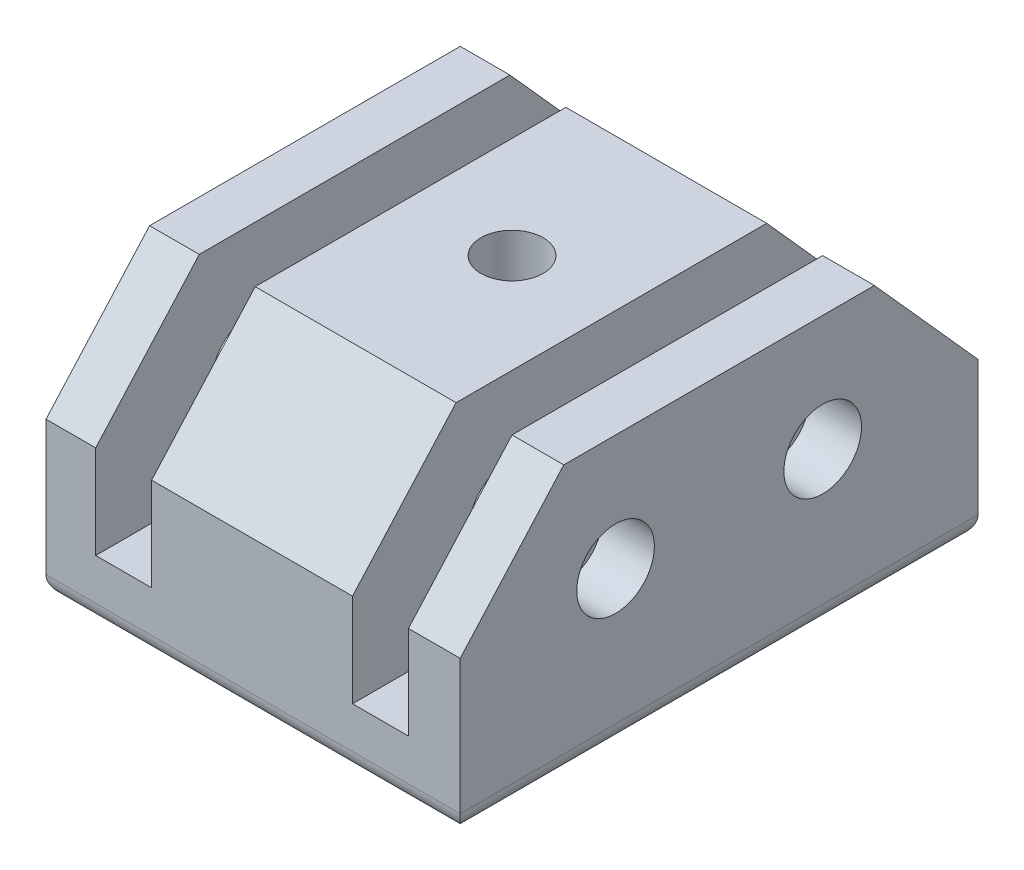
from build123d import *

# Parameters (mm, degrees)
SKETCH1_W           = 63.5
SKETCH1_H           = 6.35
BOSS_EXTRUDE1_DEPTH = 50.8
BOSS_EXTRUDE2_DEPTH = 50.8
SKETCH10_W          = 6.858
SKETCH10_H          = 25.629031657
CUT_EXTRUDE1_DEPTH  = 88.854357354
LPATTERN3_COUNT     = 2
LPATTERN3_PITCH     = 31.496
SKETCH11_R          = 4.7625
CUT_EXTRUDE2_DEPTH  = 88.854357354
FILLET1_R           = 2.54
SKETCH24_R          = 3.81
CUT_EXTRUDE10_DEPTH = 88.854357354
CUT_EXTRUDE11_DEPTH = 6.35


with BuildPart() as part:
    # Sketch1 → Boss-Extrude1 (new body)
    with BuildSketch(Plane(origin=(0, 0, 0), x_dir=(0, 0, -1), z_dir=(1, 0, 0))):
        with Locations((31.75, 3.175)):
            Rectangle(SKETCH1_W, SKETCH1_H)
    extrude(amount=-BOSS_EXTRUDE1_DEPTH)

    # Sketch2 → Boss-Extrude2 (add)
    with BuildSketch(Plane(origin=(0, 0, 0), x_dir=(0, 0, -1), z_dir=(1, 0, 0))):
        Polygon((0, 6.35), (0, 19.05), (12.7, 33.249031657), (50.8, 33.249031657), (63.5, 19.05), (63.5, 6.35), align=None)
    extrude(amount=-BOSS_EXTRUDE2_DEPTH)

    # Sketch10 → Cut-Extrude1 (cut, through all)
    with BuildSketch(Plane(origin=(0, 0, -63.5), x_dir=(-1, 0, 0), z_dir=(0, 0, -1))):
        with Locations((9.779, 20.434515829)):
            Rectangle(SKETCH10_W, SKETCH10_H)
    cut_extrude1 = extrude(amount=-CUT_EXTRUDE1_DEPTH, mode=Mode.SUBTRACT)

    # LPattern3: Cut-Extrude1 ×2
    with Locations(*[(-i * LPATTERN3_PITCH, 0, 0) for i in range(1, LPATTERN3_COUNT)]):
        add(cut_extrude1, mode=Mode.SUBTRACT)

    # Sketch11 → Cut-Extrude2 (cut, through all)
    with BuildSketch(Plane(origin=(0, 0, 0), x_dir=(0, 0, -1), z_dir=(1, 0, 0))):
        with Locations((19.05, 19.05)):
            Circle(SKETCH11_R)
        with Locations((44.45, 19.05)):
            Circle(SKETCH11_R)
    extrude(amount=-CUT_EXTRUDE2_DEPTH, mode=Mode.SUBTRACT)

    # Fillet1
    fillet1_edges = [part.edges().sort_by_distance(p)[0] for p in [
        (0, 0, -31.75),
        (-50.8, 0, -31.75),
        (-25.4, 0, -63.5),
        (-25.4, 0, 0),
    ]]
    fillet(fillet1_edges, radius=FILLET1_R)

    # Sketch24 → Cut-Extrude10 (cut, through all)
    with BuildSketch(Plane.XZ):
        with Locations(Location((-25.4, -31.75, 0), (0, 0, 270))):
            Circle(SKETCH24_R)
    extrude(amount=-CUT_EXTRUDE10_DEPTH, mode=Mode.SUBTRACT)

    # Sketch25 → Cut-Extrude11 (cut)
    with BuildSketch(Plane.XZ):
        Polygon((-29.359468146, -24.892), (-33.318936292, -31.75), (-29.359468146, -38.608), (-21.440531854, -38.608), (-17.481063708, -31.75), (-21.440531854, -24.892), align=None)
    extrude(amount=-CUT_EXTRUDE11_DEPTH, mode=Mode.SUBTRACT)


solid = part.part
